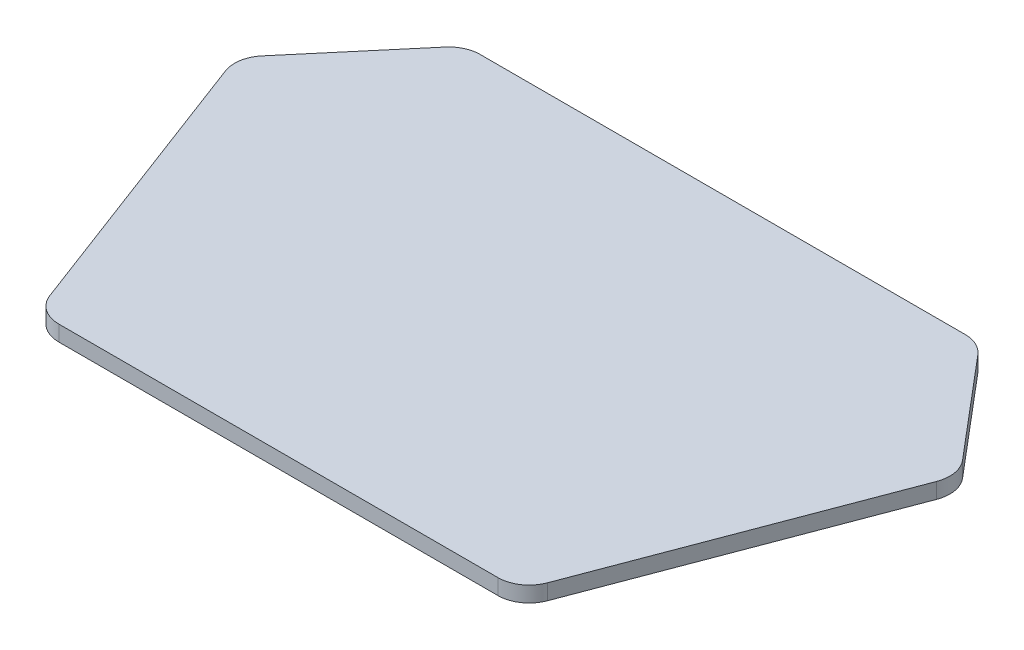
from build123d import *

# Parameters (mm, degrees)
EXTRUDE1_DEPTH = 2.286


with BuildPart() as part:
    # Sketch1 → Extrude1 (new body)
    with BuildSketch(Plane(origin=(0, 0, 0), x_dir=(1, 0, 0), z_dir=(0, 1, 0))):
        with BuildLine():
            Line((-35.587506478, 37.75591133), (35.587506478, 37.75591133))
            ThreePointArc((35.587506478, 37.75591133), (37.512064818, 37.331110288), (39.078987817, 36.135646762))
            Line((39.078987817, 36.135646762), (51.39211015, 21.570982059))
            ThreePointArc((51.39211015, 21.570982059), (52.406608959, 19.393408694), (52.177078973, 17.002101608))
            Line((52.177078973, 17.002101608), (36.497605157, -24.461395817))
            ThreePointArc((36.497605157, -24.461395817), (34.820154512, -26.605684768), (32.221154995, -27.416250797))
            Line((32.221154995, -27.416250797), (-32.221154995, -27.416250797))
            ThreePointArc((-32.221154995, -27.416250797), (-34.820154512, -26.605684768), (-36.497605157, -24.461395817))
            Line((-36.497605157, -24.461395817), (-52.177078973, 17.002101608))
            ThreePointArc((-52.177078973, 17.002101608), (-52.406608959, 19.393408694), (-51.39211015, 21.570982059))
            Line((-51.39211015, 21.570982059), (-39.078987817, 36.135646762))
            ThreePointArc((-39.078987817, 36.135646762), (-37.512064818, 37.331110288), (-35.587506478, 37.75591133))
        make_face()
    extrude(amount=-EXTRUDE1_DEPTH)


solid = part.part
